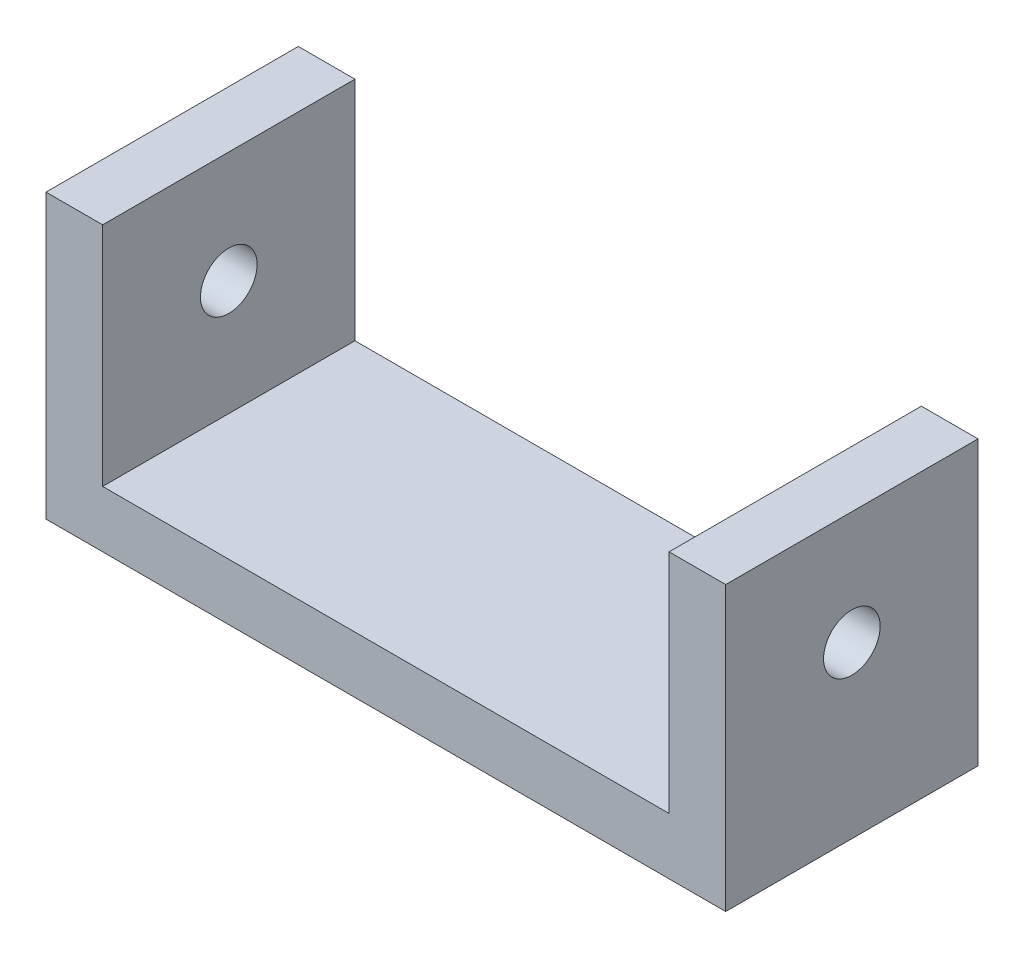
from build123d import *

# Parameters (mm, degrees)
SKETCH1_W           = 76.2
SKETCH1_H           = 28.284249084
BOSS_EXTRUDE1_DEPTH = 6.35
SKETCH2_W           = 6.35
SKETCH2_H           = 28.284249084
BOSS_EXTRUDE2_DEPTH = 25.4
SKETCH3_R           = 3.175
CUT_EXTRUDE1_DEPTH  = 6.35
SKETCH4_R           = 3.175
CUT_EXTRUDE2_DEPTH  = 7.62


with BuildPart() as part:
    # Sketch1 → Boss-Extrude1 (new body)
    with BuildSketch(Plane(origin=(0, 0, 0), x_dir=(1, 0, 0), z_dir=(0, 1, 0))):
        Rectangle(SKETCH1_W, SKETCH1_H)
    extrude(amount=BOSS_EXTRUDE1_DEPTH)

    # Sketch2 → Boss-Extrude2 (add)
    with BuildSketch(Plane(origin=(0, 6.35, 0), x_dir=(1, 0, 0), z_dir=(0, 1, 0))):
        with Locations((-34.925, 0)):
            Rectangle(SKETCH2_W, SKETCH2_H)
        with Locations((34.925, 0)):
            Rectangle(SKETCH2_W, SKETCH2_H)
    extrude(amount=BOSS_EXTRUDE2_DEPTH)

    # Sketch3 → Cut-Extrude1 (cut)
    with BuildSketch(Plane.ZY.offset(38.1)):
        with Locations((0, 19.247915812)):
            Circle(SKETCH3_R)
    extrude(amount=-CUT_EXTRUDE1_DEPTH, mode=Mode.SUBTRACT)

    # Sketch4 → Cut-Extrude2 (cut)
    with BuildSketch(Plane(origin=(38.1, 0, 0), x_dir=(0, 0, -1), z_dir=(1, 0, 0))):
        with Locations((0, 19.05)):
            Circle(SKETCH4_R)
    extrude(amount=-CUT_EXTRUDE2_DEPTH, mode=Mode.SUBTRACT)


solid = part.part
